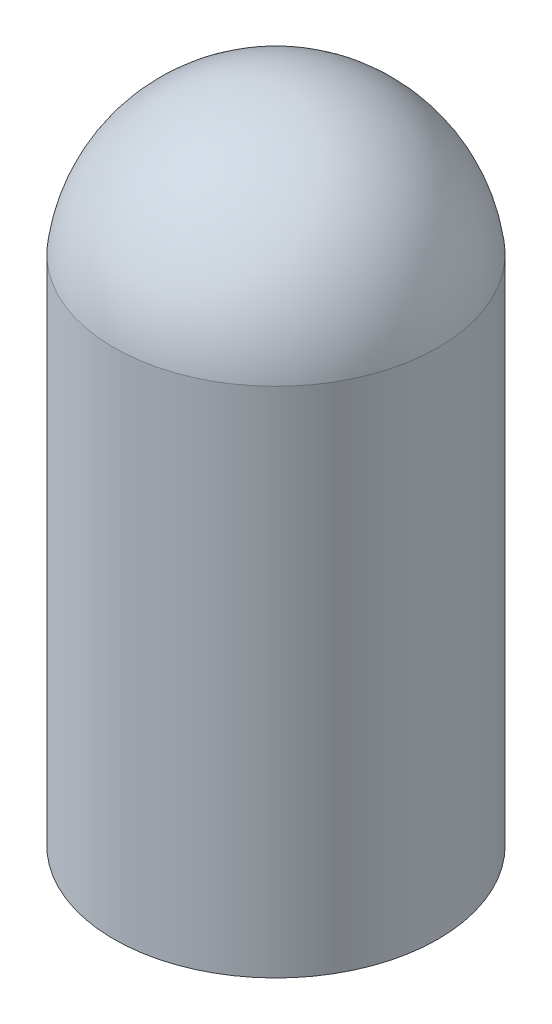
from build123d import *


with BuildPart() as part:
    # Sketch1 → Revolve1 (revolve)
    with BuildSketch(Plane.XY, mode=Mode.PRIVATE) as revolve1_sk:
        with BuildLine():
            Line((-39.6875, 0), (-39.6875, 125.476))
            ThreePointArc((-39.6875, 125.476), (-26.508915526, 150.5776683), (0, 160.629844075))
            Line((0, 160.629844075), (0, 156.819844075))
            ThreePointArc((0, 156.819844075), (-23.898322662, 147.800097501), (-35.8775, 125.239402374))
            Line((-35.8775, 125.239402374), (-35.8775, 0))
            Line((-35.8775, 0), (-39.6875, 0))
        make_face()
    revolve(revolve1_sk.sketch.rotate(Axis((0, 0, 0), (0, 1, 0)), 180), axis=Axis((0, 0, 0), (0, 1, 0)))


solid = part.part
